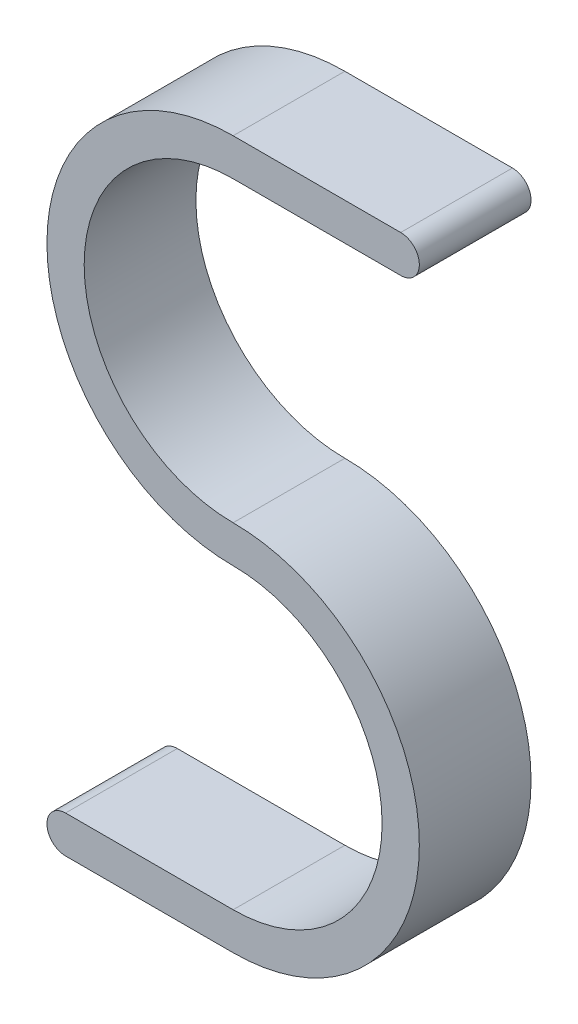
from build123d import *

# Parameters (mm, degrees)
BOSS_EXTRUDE1_DEPTH = 15


with BuildPart() as part:
    # Sketch2 → Boss-Extrude1 (new body)
    with BuildSketch(Plane.XY):
        with BuildLine():
            Line((-0.828856516, 40), (21.671184182, 40))
            ThreePointArc((21.671184182, 40), (24.171184182, 42.500020349), (21.671143484, 45))
            Line((21.671143484, 45), (-0.828856516, 45))
            ThreePointArc((-0.828856516, 45), (-25.828856516, 20), (-0.828856516, -5))
            ThreePointArc((-0.828856516, -5), (19.171143484, -25), (-0.828856516, -45))
            Line((-0.828856516, -45), (-23.328897213, -45))
            ThreePointArc((-23.328897213, -45), (-25.828897214, -47.500020349), (-23.328856516, -50))
            Line((-23.328856516, -50), (-0.828856516, -50))
            ThreePointArc((-0.828856516, -50), (24.171143484, -25), (-0.828856516, 0))
            ThreePointArc((-0.828856516, 0), (-20.828856516, 20), (-0.828856516, 40))
        make_face()
    extrude(amount=BOSS_EXTRUDE1_DEPTH)


solid = part.part
